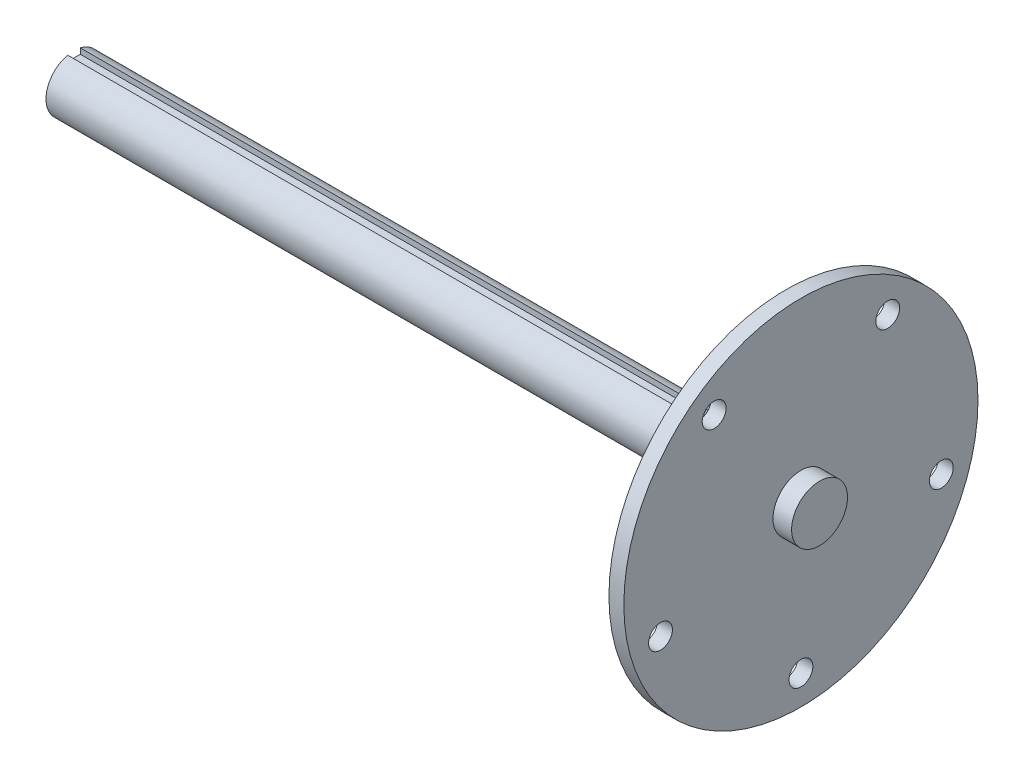
from build123d import *

# Parameters (mm, degrees)
SKETCH1_R                = 60.325
SKETCH1_R_2              = 4.064
BOSS_EXTRUDE1_DEPTH      = 5.08
BOSS_EXTRUDE2_DEPTH      = 6.35
BOSS_EXTRUDE2_DEPTH_BACK = 247.65
SKETCH2_R                = 9.525
SKETCH4_W                = 4.318
SKETCH4_H                = 2.15
CUT_EXTRUDE1_DEPTH       = 228.6


with BuildPart() as part:
    # Sketch1 → Boss-Extrude1 (new body)
    with BuildSketch(Plane(origin=(0, 0, 0), x_dir=(0, 0, -1), z_dir=(1, 0, 0))):
        Circle(SKETCH1_R)
        with Locations((0, -50.292)):
            Circle(SKETCH1_R_2, mode=Mode.SUBTRACT)
        with Locations((-47.830534318, -15.541082681)):
            Circle(SKETCH1_R_2, mode=Mode.SUBTRACT)
        with Locations((-29.560895908, 40.687082681)):
            Circle(SKETCH1_R_2, mode=Mode.SUBTRACT)
        with Locations((29.560895908, 40.687082681)):
            Circle(SKETCH1_R_2, mode=Mode.SUBTRACT)
        with Locations((47.830534318, -15.541082681)):
            Circle(SKETCH1_R_2, mode=Mode.SUBTRACT)
    extrude(amount=BOSS_EXTRUDE1_DEPTH)

    # Sketch2 → Boss-Extrude2 (add, two sides: drawn at the far end of the back side and taken through both)
    with BuildSketch(Plane(origin=(5.08, 0, 0), x_dir=(0, 0, -1), z_dir=(1, 0, 0)).offset(-BOSS_EXTRUDE2_DEPTH_BACK)):
        Circle(SKETCH2_R)
    extrude(amount=BOSS_EXTRUDE2_DEPTH + BOSS_EXTRUDE2_DEPTH_BACK)

    # Sketch4 → Cut-Extrude1 (cut)
    with BuildSketch(Plane.ZY.offset(242.57)):
        with Locations((0, 8.45)):
            Rectangle(SKETCH4_W, SKETCH4_H)
    extrude(amount=-CUT_EXTRUDE1_DEPTH, mode=Mode.SUBTRACT)


solid = part.part
